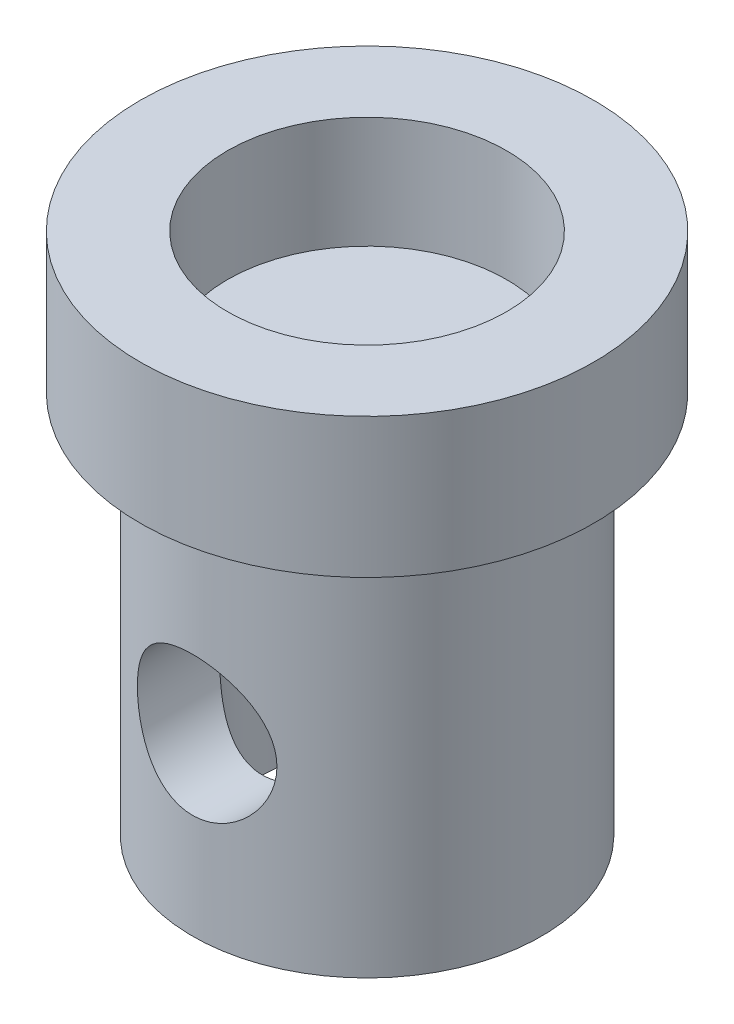
from build123d import *

# Parameters (mm, degrees)
CUT_EXTRUDE_1_DEPTH      = 18.592612086
CUT_EXTRUDE_1_DEPTH_BACK = 18.592612086
SKETCH_2_R               = 2


with BuildPart() as part:
    # 草图1 → 旋转1 (revolve)
    with BuildSketch(Plane.XY, mode=Mode.PRIVATE) as revolve_1_sk:
        with BuildLine():
            Line((6.5, 11), (6.5, 15))
            Line((6.5, 15), (4, 15))
            Line((4, 15), (4, 11.8))
            Line((4, 11.8), (0, 11.8))
            Line((0, 11.8), (0, 10.3))
            Line((0, 10.3), (3, 10.3))
            Line((3, 10.3), (3, 0))
            Line((3, 0), (5, 0))
            Line((5, 0), (5, 10))
            ThreePointArc((5, 10), (5.292893219, 10.707106781), (6, 11))
            Line((6, 11), (6.5, 11))
        make_face()
    revolve(revolve_1_sk.sketch.rotate(Axis((0, 11.8, 0), (0, -1, 0)), 180), axis=Axis((0, 11.8, 0), (0, -1, 0)))

    # 草图2 → 切除-拉伸1 (cut, two sides: drawn at the far end of the back side and taken through both)
    with BuildSketch(Plane.XY.offset(-CUT_EXTRUDE_1_DEPTH_BACK)):
        with Locations((0, 5)):
            Circle(SKETCH_2_R)
    extrude(amount=CUT_EXTRUDE_1_DEPTH + CUT_EXTRUDE_1_DEPTH_BACK, mode=Mode.SUBTRACT)


solid = part.part
